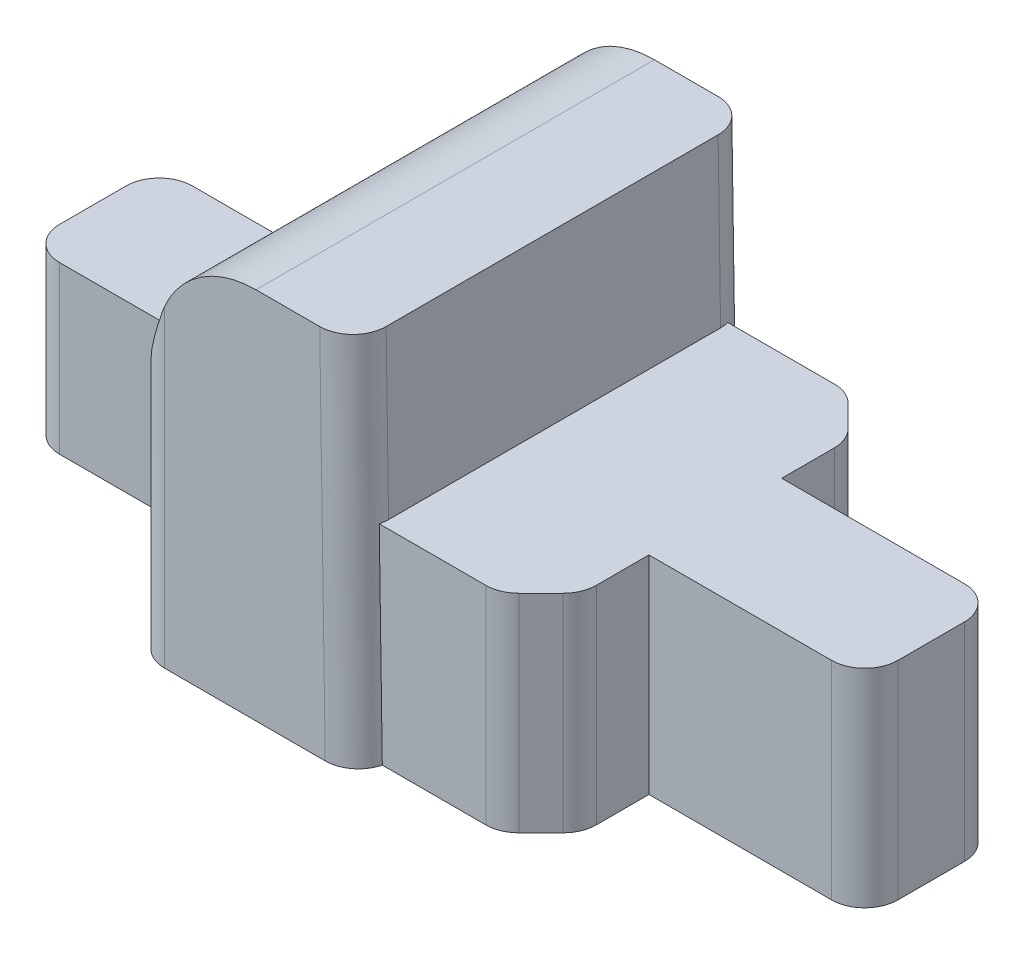
from build123d import *

# Parameters (mm, degrees)
SKETCH2_W           = 660.4
SKETCH2_H           = 508
BOSS_EXTRUDE1_DEPTH = 406.4
BOSS_EXTRUDE2_DEPTH = 1219.2
BOSS_EXTRUDE3_DEPTH = 1066.8
SKETCH5_W           = 660.4
SKETCH5_H           = 635
BOSS_EXTRUDE4_DEPTH = 406.4
FILLET2_R           = 101.6
FILLET3_R           = 101.6
CHAMFER1_SIZE       = 127
FILLET4_R           = 101.6
CHAMFER3_SIZE       = 127
FILLET5_R           = 101.6
FILLET6_R           = 304.8


with BuildPart() as part:
    # Sketch2 → Boss-Extrude1 (new body)
    with BuildSketch(Plane.XY.offset(203.2)):
        with Locations((-330.2, 254)):
            Rectangle(SKETCH2_W, SKETCH2_H)
    extrude(amount=-BOSS_EXTRUDE1_DEPTH)

    # Sketch3 → Boss-Extrude2 (add)
    with BuildSketch(Plane.XY.offset(609.6)):
        Polygon((0, 0), (0, 508), (237.061244979, 1143), (745.061244979, 1143), (762, 0), align=None)
    extrude(amount=-BOSS_EXTRUDE2_DEPTH)

    # Sketch4 → Boss-Extrude3 (add)
    with BuildSketch(Plane.XY.offset(533.4)):
        Polygon((1244.6, 635), (752.589580544, 635), (762, 0), (1244.6, 0), align=None)
    extrude(amount=-BOSS_EXTRUDE3_DEPTH)

    # Sketch5 → Boss-Extrude4 (add)
    with BuildSketch(Plane.XY.offset(203.2)):
        with Locations((1574.8, 317.5)):
            Rectangle(SKETCH5_W, SKETCH5_H)
    extrude(amount=-BOSS_EXTRUDE4_DEPTH)

    # Fillet2
    fillet2_edges = [part.edges().sort_by_distance(p)[0] for p in [
        (-660.4, 254, -203.2),
        (-660.4, 254, 203.2),
    ]]
    fillet(fillet2_edges, radius=FILLET2_R)

    # Fillet3
    fillet3_edges = [part.edges().sort_by_distance(p)[0] for p in [
        (1905, 317.5, -203.2),
        (1905, 317.5, 203.2),
    ]]
    fillet(fillet3_edges, radius=FILLET3_R)

    # Chamfer1
    chamfer1_edges = [part.edges().sort_by_distance(p)[0] for p in [
        (1244.6, 317.5, -533.4),
        (1244.6, 317.5, 533.4),
    ]]
    chamfer(chamfer1_edges, length=CHAMFER1_SIZE)

    # Fillet4
    fillet4_edges = [part.edges().sort_by_distance(p)[0] for p in [
        (1244.6, 317.5, -406.4),
        (1117.6, 317.5, -533.4),
        (1117.6, 317.5, 533.4),
        (1244.6, 317.5, 406.4),
    ]]
    fillet(fillet4_edges, radius=FILLET4_R)

    # Chamfer3
    chamfer3_edges = [part.edges().sort_by_distance(p)[0] for p in [
        (0, 254, -609.6),
        (0, 254, 609.6),
    ]]
    chamfer(chamfer3_edges, length=CHAMFER3_SIZE)

    # Fillet5
    fillet5_edges = [part.edges().sort_by_distance(p)[0] for p in [
        (753.530622489, 571.5, 609.6),
        (753.530622489, 571.5, -609.6),
        (127, 424.093175726, -609.6),
        (0, 254, -482.6),
        (127, 424.093175726, 609.6),
        (0, 254, 482.6),
    ]]
    fillet(fillet5_edges, radius=FILLET5_R)

    # Fillet6
    fillet6_edges = [part.edges().sort_by_distance(p)[0] for p in [
        (237.061244979, 1143, 0),
    ]]
    fillet(fillet6_edges, radius=FILLET6_R)


solid = part.part
